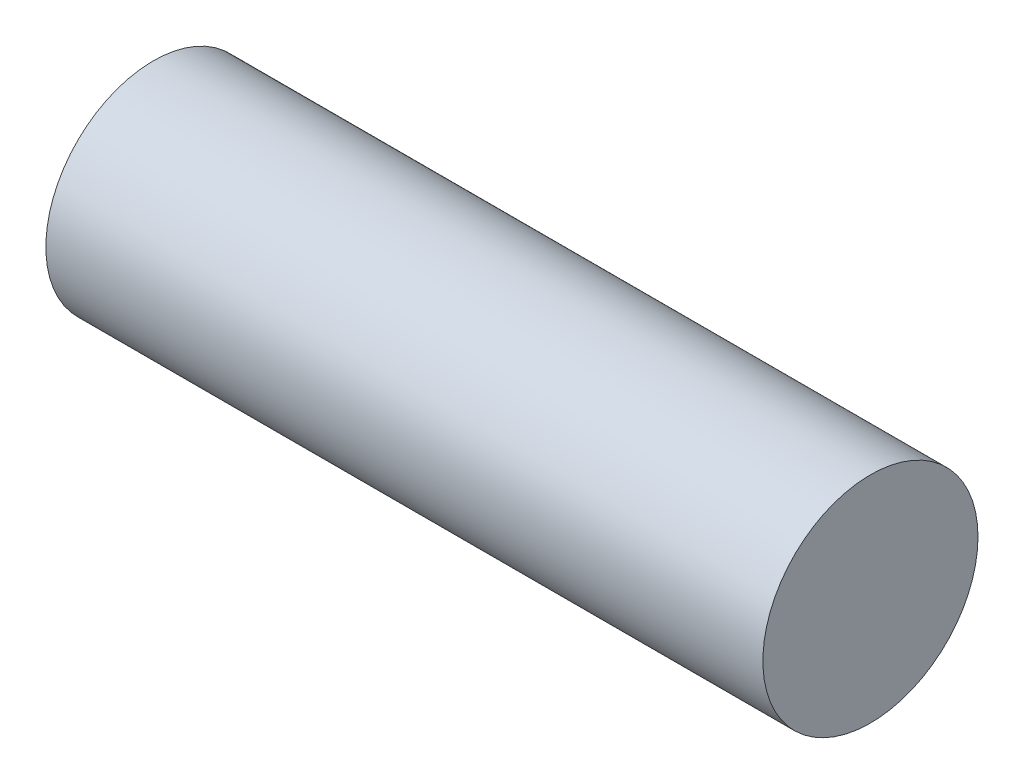
from build123d import *

# Parameters (mm, degrees)
SKETCH1_R           = 4.7625
BOSS_EXTRUDE1_DEPTH = 31.75


with BuildPart() as part:
    # Sketch1 → Boss-Extrude1 (new body)
    with BuildSketch(Plane(origin=(0, 0, 0), x_dir=(0, 0, -1), z_dir=(1, 0, 0))):
        Circle(SKETCH1_R)
    extrude(amount=BOSS_EXTRUDE1_DEPTH)


solid = part.part
